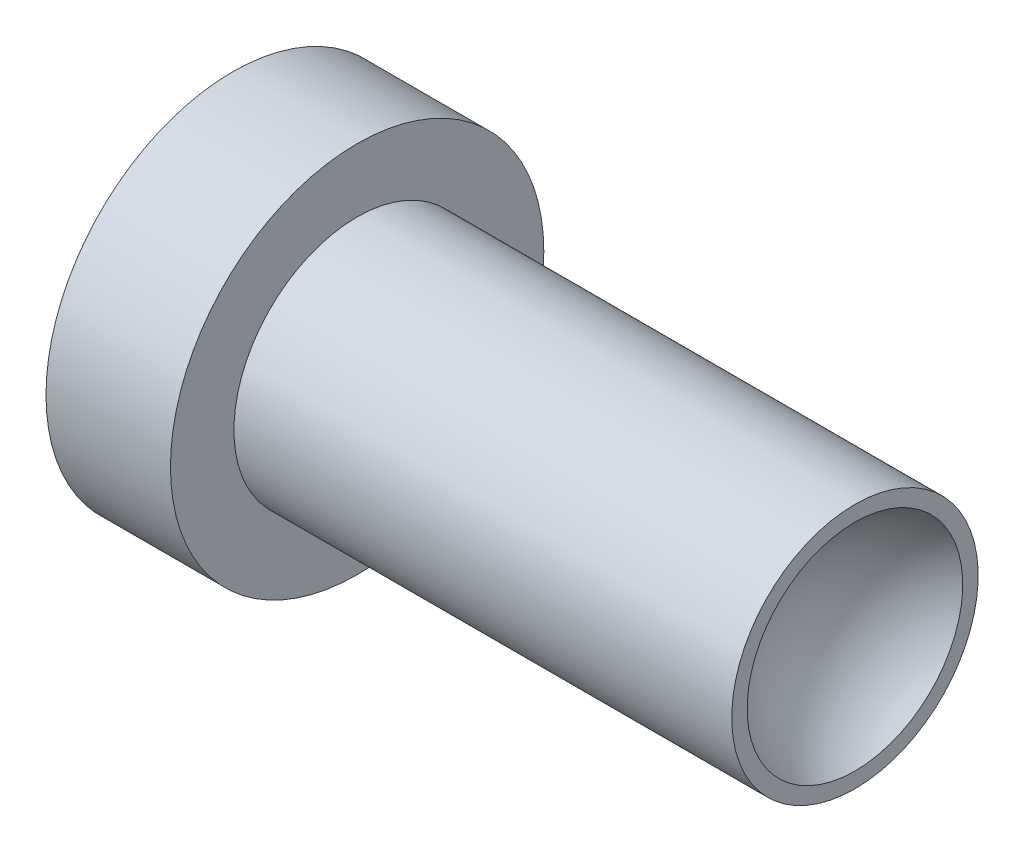
from build123d import *


with BuildPart() as part:
    # Sketch1 → Revolve1 (revolve)
    with BuildSketch(Plane.XY):
        Polygon((0, 0), (0, 19.05), (12.7, 19.05), (12.7, 12.573), (63.5, 12.573), (63.5, 0), align=None)
    revolve(axis=Axis((63.5, 0, 0), (-1, 0, 0)))

    # Sketch2 → Cut-Revolve1 (revolve, cut)
    with BuildSketch(Plane.XY):
        with BuildLine():
            Line((57.15, 0), (63.5, 0))
            Line((63.5, 0), (63.5, 10.998522628))
            ThreePointArc((63.5, 10.998522628), (58.851477372, 6.35), (57.15, 0))
        make_face()
    revolve(axis=Axis((57.15, 0, 0), (1, 0, 0)), mode=Mode.SUBTRACT)


solid = part.part
